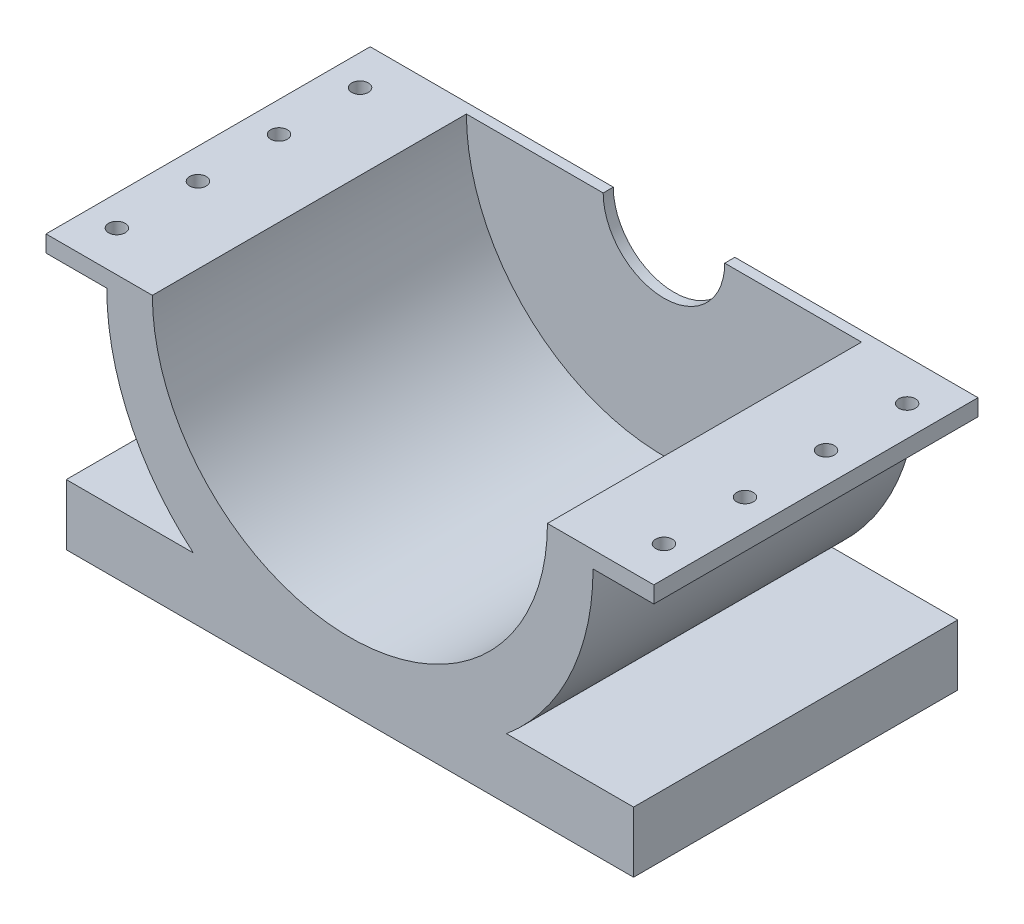
from build123d import *

# Parameters (mm, degrees)
BOSS_EXTRUDE1_DEPTH = 4
CUT_EXTRUDE1_DEPTH  = 7.75
CUT_EXTRUDE2_DEPTH  = 7.75
SKETCH4_R           = 0.205
CUT_EXTRUDE3_DEPTH  = 2.75


with BuildPart() as part:
    # Sketch1 → Boss-Extrude1 (new, symmetric)
    with BuildSketch(Plane.XY):
        with BuildLine():
            Line((7.5, 0), (6, 0))
            ThreePointArc((6, 0), (5.439903034, -2.531295119), (3.864181673, -4.59))
            Line((3.864181673, -4.59), (7, -4.59))
            Line((7, -4.59), (7, -6.09))
            Line((7, -6.09), (-7, -6.09))
            Line((-7, -6.09), (-7, -4.59))
            Line((-7, -4.59), (-3.864181673, -4.59))
            ThreePointArc((-3.864181673, -4.59), (-5.439903034, -2.531295119), (-6, 0))
            Line((-6, 0), (-7.5, 0))
            Line((-7.5, 0), (-7.5, 0.41))
            Line((-7.5, 0.41), (7.5, 0.41))
            Line((7.5, 0.41), (7.5, 0))
        make_face()
    extrude(amount=BOSS_EXTRUDE1_DEPTH, both=True)

    # Sketch2 → Cut-Extrude1 (cut)
    with BuildSketch(Plane.XY.offset(4)):
        with BuildLine():
            Line((-4.875, 0.41), (4.875, 0.41))
            ThreePointArc((4.875, 0.41), (0, -4.465), (-4.875, 0.41))
        make_face()
    extrude(amount=-CUT_EXTRUDE1_DEPTH, mode=Mode.SUBTRACT)

    # Sketch3 → Cut-Extrude2 (cut)
    with BuildSketch(Plane(origin=(0, 0, -4), x_dir=(-1, 0, 0), z_dir=(0, 0, -1))):
        with BuildLine():
            Line((-1.5, 0.41), (1.5, 0.41))
            ThreePointArc((1.5, 0.41), (0, -1.09), (-1.5, 0.41))
        make_face()
    extrude(amount=-CUT_EXTRUDE2_DEPTH, mode=Mode.SUBTRACT)

    # Sketch4 → Cut-Extrude3 (cut)
    with BuildSketch(Plane(origin=(0, 0.41, 0), x_dir=(1, 0, 0), z_dir=(0, 1, 0))):
        with Locations(Location((6.75, 3, 0), (0, 0, 180))):
            Circle(SKETCH4_R)
        with Locations(Location((6.75, 1, 0), (0, 0, 180))):
            Circle(SKETCH4_R)
        with Locations(Location((6.75, -1, 0), (0, 0, 180))):
            Circle(SKETCH4_R)
        with Locations(Location((6.75, -3, 0), (0, 0, 180))):
            Circle(SKETCH4_R)
    cut_extrude3 = extrude(amount=-CUT_EXTRUDE3_DEPTH, mode=Mode.SUBTRACT)

    # Mirror1: Cut-Extrude3 across plane
    add(cut_extrude3.mirror(Plane(origin=(0, 0, 0), x_dir=(0, 0, 1), z_dir=(1, 0, 0))), mode=Mode.SUBTRACT)


solid = part.part
